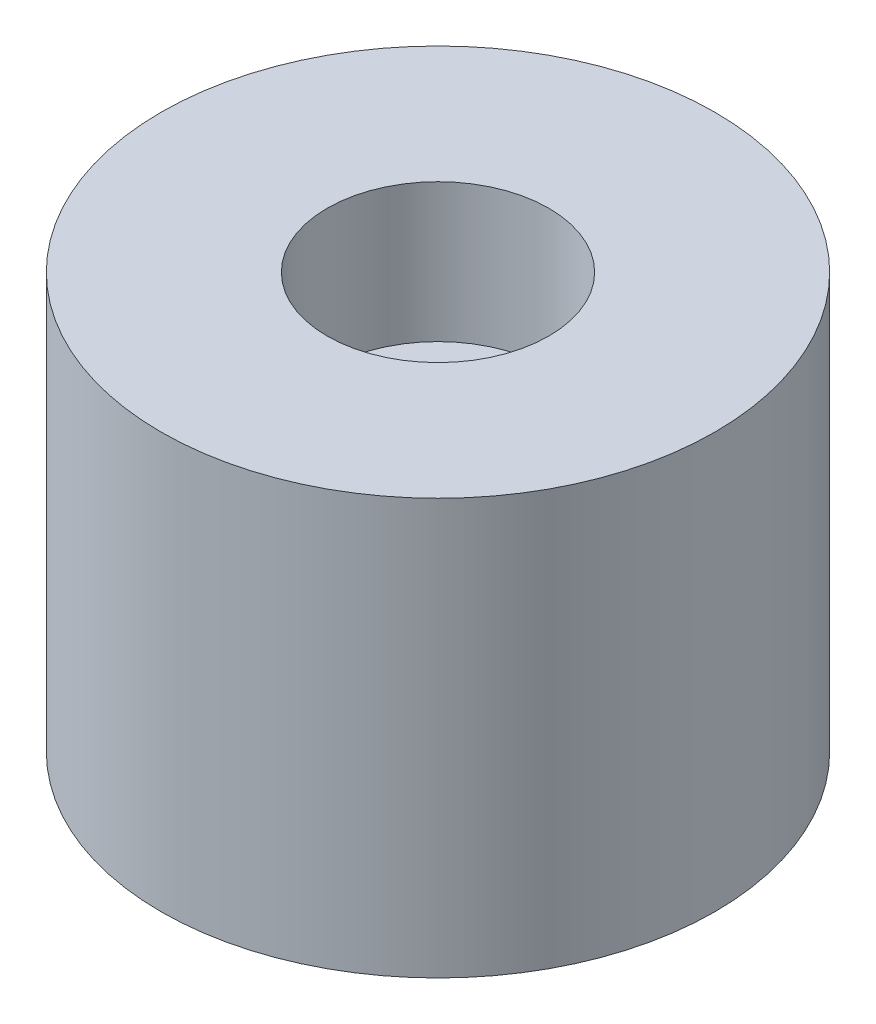
from build123d import *

# Parameters (mm, degrees)
SKETCH1_R           = 10
BOSS_EXTRUDE1_DEPTH = 15
SKETCH2_R           = 4
CUT_EXTRUDE1_DEPTH  = 5


with BuildPart() as part:
    # Sketch1 → Boss-Extrude1 (new body)
    with BuildSketch(Plane(origin=(0, 0, 0), x_dir=(1, 0, 0), z_dir=(0, 1, 0))):
        with Locations(Location((0, 0, 0), (0, 0, 270))):
            Circle(SKETCH1_R)
    extrude(amount=BOSS_EXTRUDE1_DEPTH)

    # Sketch2 → Cut-Extrude1 (cut)
    with BuildSketch(Plane(origin=(0, 15, 0), x_dir=(1, 0, 0), z_dir=(0, 1, 0))):
        with Locations(Location((0, 0, 0), (0, 0, 270))):
            Circle(SKETCH2_R)
    extrude(amount=-CUT_EXTRUDE1_DEPTH, mode=Mode.SUBTRACT)


solid = part.part
